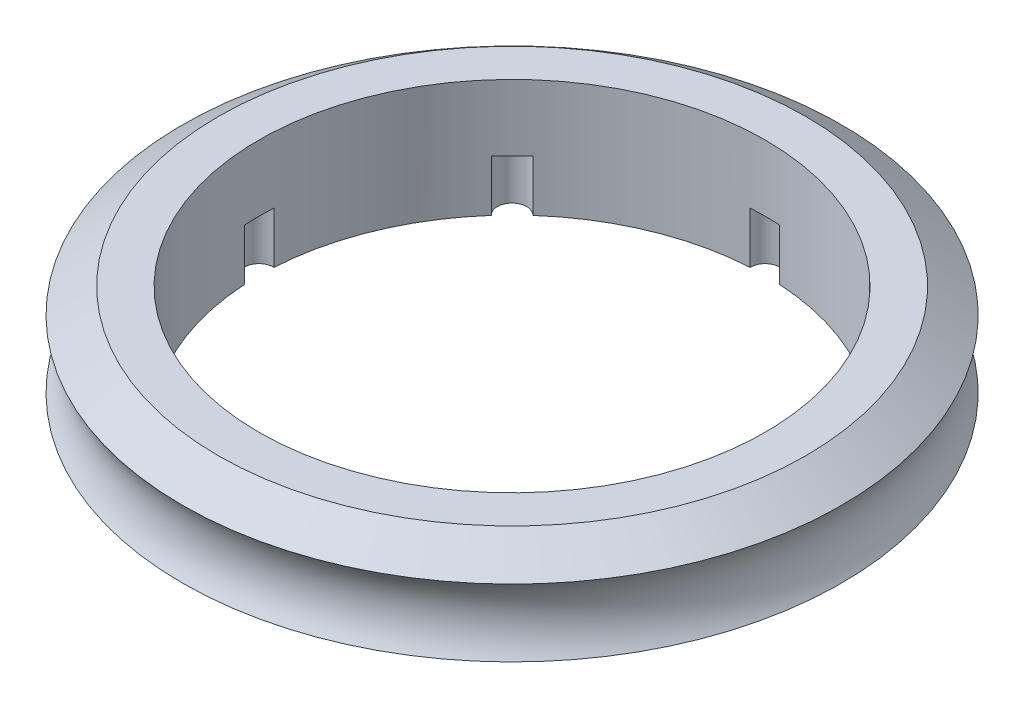
from build123d import *

# Parameters (mm, degrees)
SKETCH3_R          = 4
CUT_EXTRUDE1_DEPTH = 14


with BuildPart() as part:
    # Sketch2 → Revolve1 (revolve)
    with BuildSketch(Plane(origin=(0, 0, 0), x_dir=(0, 0, -1), z_dir=(1, 0, 0)), mode=Mode.PRIVATE) as revolve1_sk:
        with BuildLine():
            Line((68.94, 0), (68.94, 32))
            Line((68.94, 32), (80, 32))
            Line((80, 32), (89.743935399, 25.177222982))
            ThreePointArc((89.743935399, 25.177222982), (86.850368108, 16), (89.743935399, 6.822777018))
            Line((89.743935399, 6.822777018), (80, 0))
            Line((80, 0), (68.94, 0))
        make_face()
    revolve(revolve1_sk.sketch.rotate(Axis((0, 24.773264932, 0), (0, -1, 0)), 180), axis=Axis((0, 24.773264932, 0), (0, -1, 0)))

    # Sketch3 → Cut-Extrude1 (cut)
    with BuildSketch(Plane(origin=(0, 0, 0), x_dir=(1, 0, 0), z_dir=(0, 1, 0))):
        with Locations((0, 68.94)):
            Circle(SKETCH3_R)
        with Locations((48.747941495, 48.747941495)):
            Circle(SKETCH3_R)
        with Locations((68.94, 0)):
            Circle(SKETCH3_R)
        with Locations((48.747941495, -48.747941495)):
            Circle(SKETCH3_R)
        with Locations((0, -68.94)):
            Circle(SKETCH3_R)
        with Locations((-48.747941495, -48.747941495)):
            Circle(SKETCH3_R)
        with Locations((-68.94, 0)):
            Circle(SKETCH3_R)
        with Locations((-48.747941495, 48.747941495)):
            Circle(SKETCH3_R)
    extrude(amount=CUT_EXTRUDE1_DEPTH, mode=Mode.SUBTRACT)


solid = part.part
